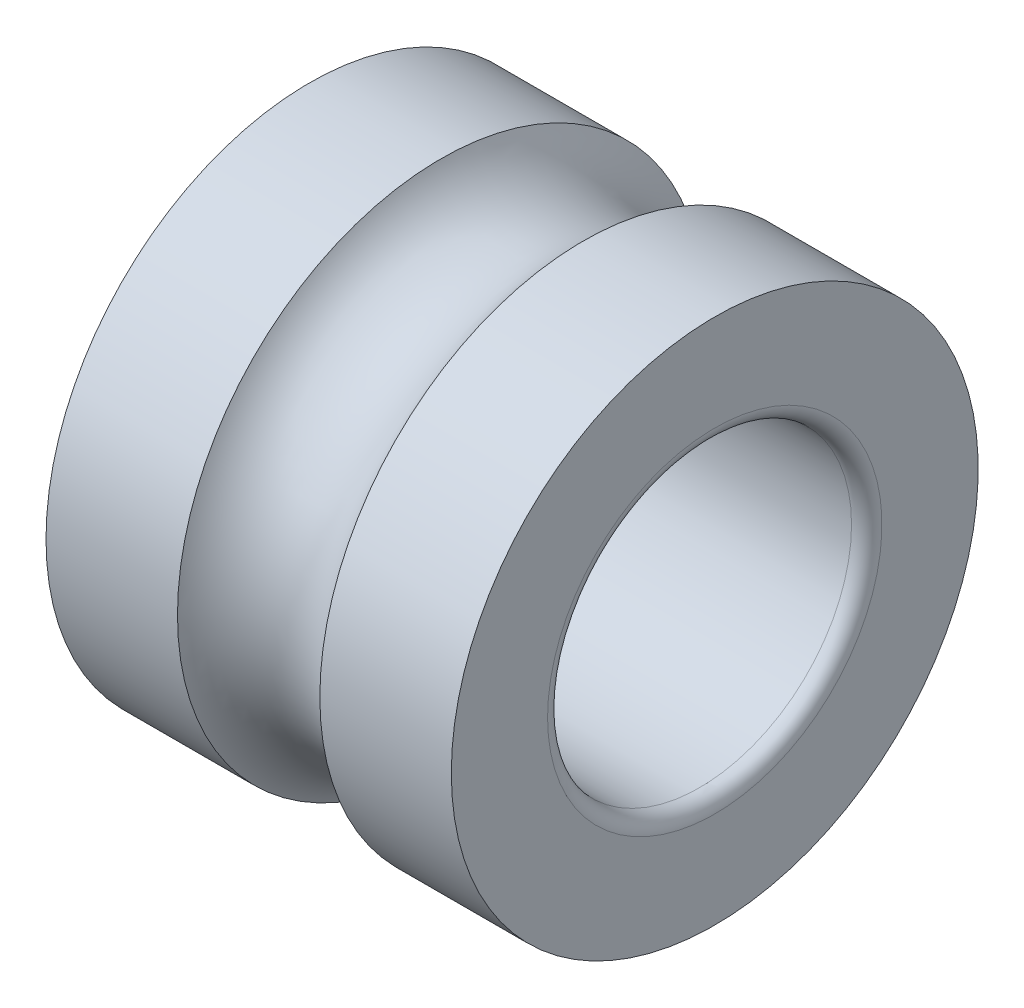
from build123d import *


with BuildPart() as part:
    # Sketch1 → Revolve1 (revolve)
    with BuildSketch(Plane.XY, mode=Mode.PRIVATE) as revolve1_sk:
        with BuildLine():
            Line((0.15, 1.5), (3.85, 1.5))
            ThreePointArc((3.85, 1.5), (3.956066017, 1.543933983), (4, 1.65))
            Line((4, 1.65), (4, 2.6))
            Line((4, 2.6), (2.702521174, 2.6))
            ThreePointArc((2.702521174, 2.6), (2, 2.176), (1.297478826, 2.6))
            Line((1.297478826, 2.6), (0, 2.6))
            Line((0, 2.6), (0, 1.65))
            ThreePointArc((0, 1.65), (0.043933983, 1.543933983), (0.15, 1.5))
        make_face()
    revolve(revolve1_sk.sketch.rotate(Axis((50, 0, 0), (-1, 0, 0)), 270), axis=Axis((50, 0, 0), (-1, 0, 0)))


solid = part.part
